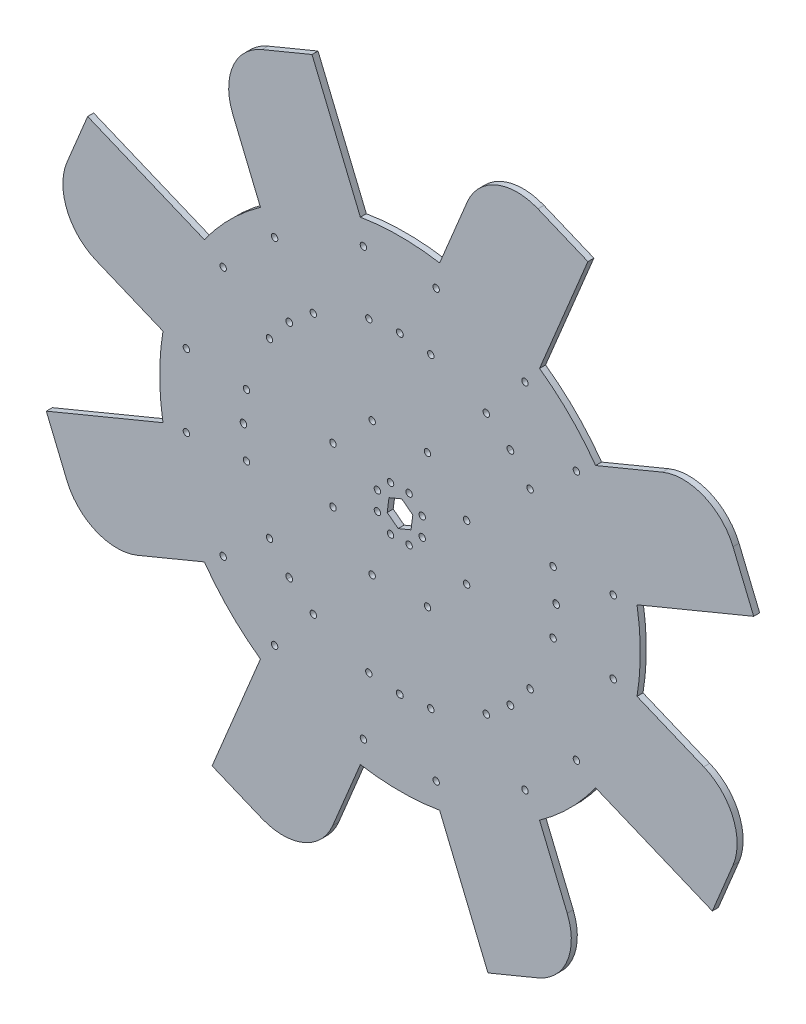
from build123d import *

# Parameters (mm, degrees)
SKETCH1_R            = 127
BOSS_EXTRUDE1_DEPTH  = 3.175
M3_CLEARANCE_HOLE1_D = 3.4
CIRPATTERN1_COUNT    = 8
BOSS_EXTRUDE2_DEPTH  = 3.175
CIRPATTERN2_COUNT    = 8
CUT_EXTRUDE1_REACH   = 266.384


with BuildPart() as part:
    # Sketch1 → Boss-Extrude1 (new body)
    with BuildSketch(Plane.XY):
        Circle(SKETCH1_R)
    extrude(amount=BOSS_EXTRUDE1_DEPTH)

    # M3 Clearance Hole1 (through all)
    with Locations(Plane(origin=(0, 0, 0), x_dir=(-1, 0, 0), z_dir=(0, 0, -1))):
        with Locations((-58.2494214, 58.493652703), (-82.549819355, -0.172697611), (-93.238867767, 66.113565457), (-112.679186132, 19.180485205), (-11.733270063, 4.860079591), (-68.767621753, 45.667457762), (-80.917820731, 16.334282605), (-35.199810189, 14.580238773)):
            m3_clearance_hole1 = Hole(M3_CLEARANCE_HOLE1_D / 2)

    # CirPattern1: M3 Clearance Hole1 ×8 about axis
    cirpattern1_axis = Axis((-0.09749486, -0.040383693, 0), (0, 0, 1))
    for i in range(1, CIRPATTERN1_COUNT):
        add(m3_clearance_hole1.rotate(cirpattern1_axis, i * 360 / CIRPATTERN1_COUNT), mode=Mode.SUBTRACT)

    # Sketch6 → Boss-Extrude2 (add)
    with BuildSketch(Plane(origin=(0, 0, 0), x_dir=(-1, 0, 0), z_dir=(0, 0, -1))):
        with BuildLine():
            Line((-100.530886518, 72.570613756), (-138.664014222, 88.365872427))
            ThreePointArc((-138.664014222, 88.365872427), (-160.534372382, 88.365872427), (-175.999050943, 72.901193866))
            Line((-175.999050943, 72.901193866), (-186.934230023, 46.501336224))
            Line((-186.934230023, 46.501336224), (-122.401244677, 19.770898473))
            Line((-122.401244677, 19.770898473), (-100.530886518, 72.570613756))
        make_face()
    boss_extrude2 = extrude(amount=-BOSS_EXTRUDE2_DEPTH)

    # CirPattern2: Boss-Extrude2 ×8 about axis
    cirpattern2_axis = Axis((0, 0, 0), (0, 0, 1))
    for i in range(1, CIRPATTERN2_COUNT):
        add(boss_extrude2.rotate(cirpattern2_axis, i * 360 / CIRPATTERN2_COUNT))

    # Sketch8 → Cut-Extrude1 (cut, up to next)
    with BuildSketch(Plane(origin=(0, 0, 0), x_dir=(-1, 0, 0), z_dir=(0, 0, -1)), mode=Mode.PRIVATE) as cut_extrude1_sk1:
        Polygon((-6.774206629, 2.80596826), (-5.81714311, -4.463650901), (0.957063519, -7.269619162), (6.774206629, -2.80596826), (5.81714311, 4.463650901), (-0.957063519, 7.269619162), align=None)
    cut_extrude1_tool1 = extrude(cut_extrude1_sk1.sketch, amount=-CUT_EXTRUDE1_REACH, mode=Mode.PRIVATE) & part.part
    add(cut_extrude1_tool1.solids().sort_by_distance((0, 0, 0))[0], mode=Mode.SUBTRACT)


solid = part.part
